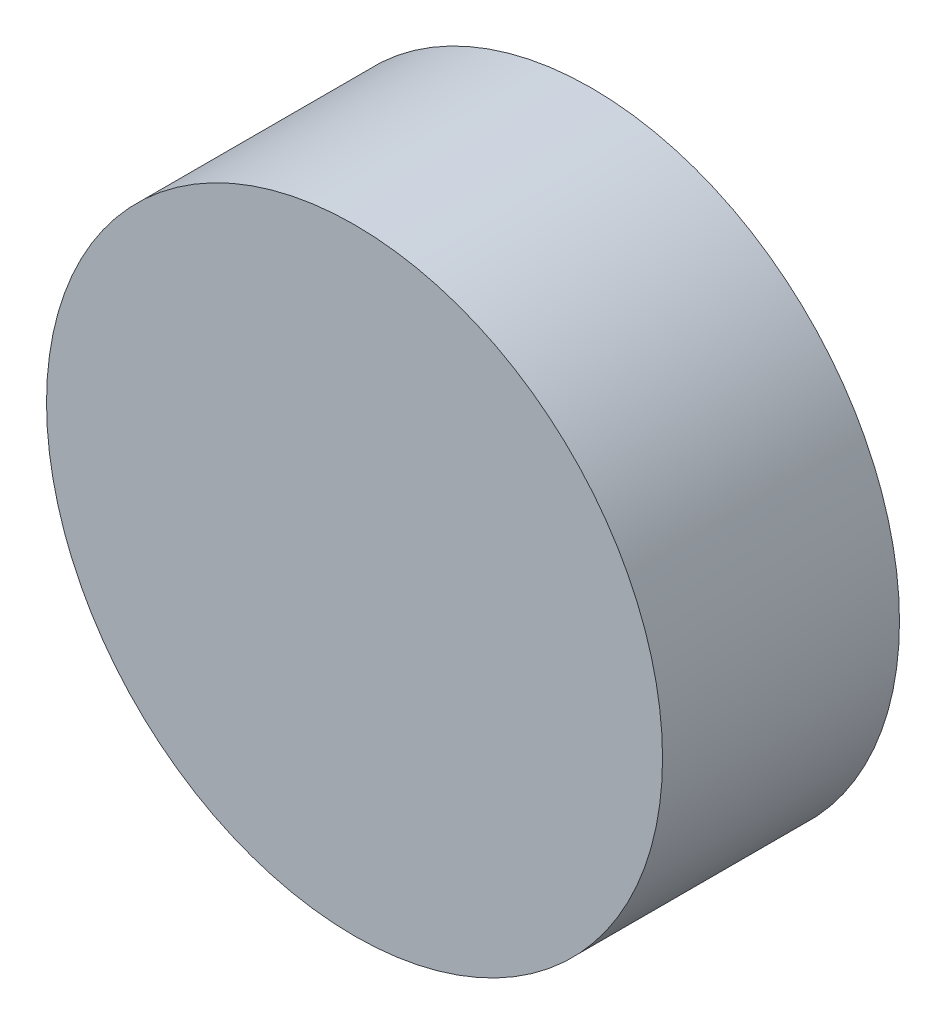
from build123d import *

# Parameters (mm, degrees)
SKETCH_1_R          = 32.5
CS_LEFT_WHEEL_DEPTH = 25


with BuildPart() as part:
    # Эскиз1 → CS_LEFT_WHEEL (new body)
    with BuildSketch(Plane.XY):
        Circle(SKETCH_1_R)
    extrude(amount=CS_LEFT_WHEEL_DEPTH)


solid = part.part
